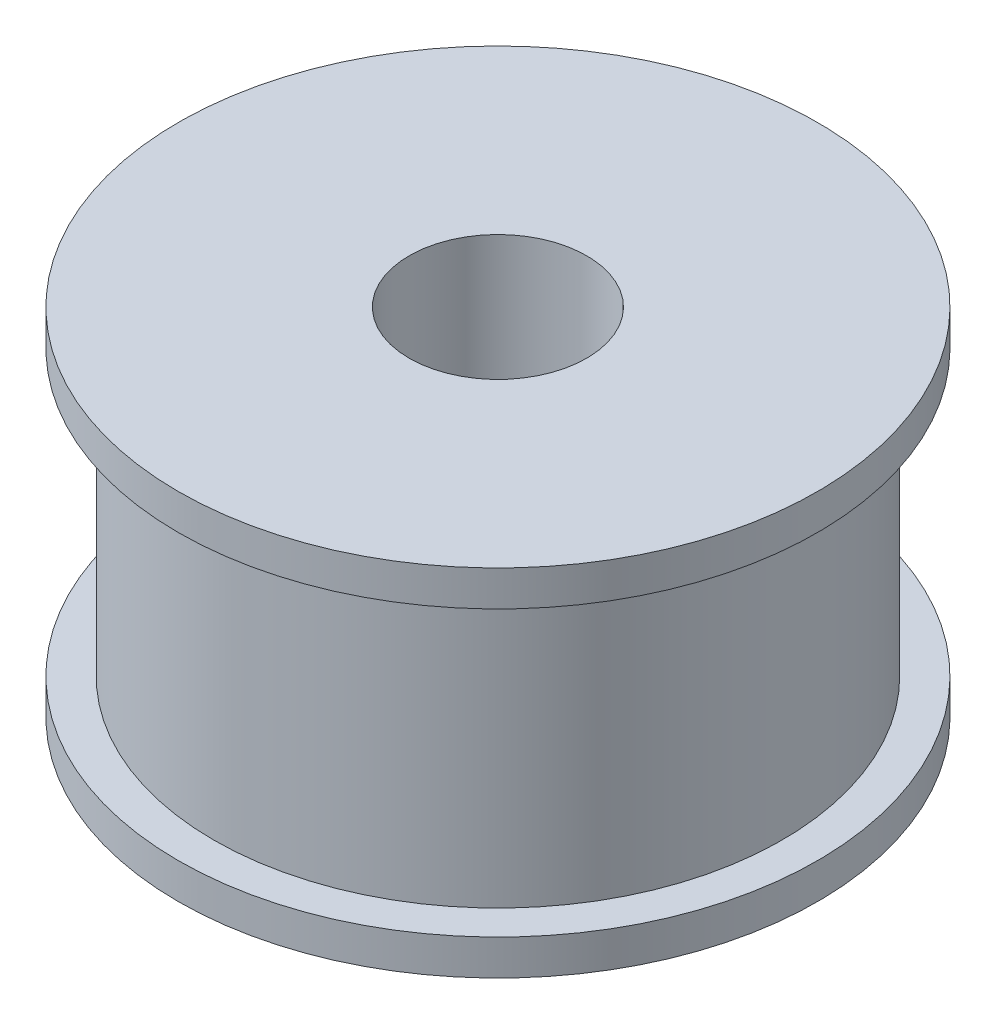
from build123d import *

# Parameters (mm, degrees)
SKETCH_1_R      = 9
SKETCH_1_R_2    = 2.5
EXTRUDE_1_DEPTH = 1
SKETCH_2_R      = 8
SKETCH_2_R_2    = 2.5
EXTRUDE_2_DEPTH = 8
SKETCH_3_R      = 9
SKETCH_3_R_2    = 2.5
EXTRUDE_3_DEPTH = 1


with BuildPart() as part:
    # Эскиз1 → Бобышка-Вытянуть1 (new body)
    with BuildSketch(Plane(origin=(0, 0, 0), x_dir=(1, 0, 0), z_dir=(0, 1, 0))):
        with Locations(Location((0, 0, 0), (0, 0, 270))):
            Circle(SKETCH_1_R)
        with Locations(Location((0, 0, 0), (0, 0, 270))):
            Circle(SKETCH_1_R_2, mode=Mode.SUBTRACT)
    extrude(amount=EXTRUDE_1_DEPTH)

    # Эскиз2 → Бобышка-Вытянуть2 (add)
    with BuildSketch(Plane(origin=(0, 1, 0), x_dir=(1, 0, 0), z_dir=(0, 1, 0))):
        with Locations(Location((0, 0, 0), (0, 0, 270))):
            Circle(SKETCH_2_R)
        with Locations(Location((0, 0, 0), (0, 0, 270))):
            Circle(SKETCH_2_R_2, mode=Mode.SUBTRACT)
    extrude(amount=EXTRUDE_2_DEPTH)

    # Эскиз3 → Бобышка-Вытянуть3 (add)
    with BuildSketch(Plane(origin=(0, 9, 0), x_dir=(1, 0, 0), z_dir=(0, 1, 0))):
        with Locations(Location((0, 0, 0), (0, 0, 270))):
            Circle(SKETCH_3_R)
        with Locations(Location((0, 0, 0), (0, 0, 270))):
            Circle(SKETCH_3_R_2, mode=Mode.SUBTRACT)
    extrude(amount=EXTRUDE_3_DEPTH)


solid = part.part
